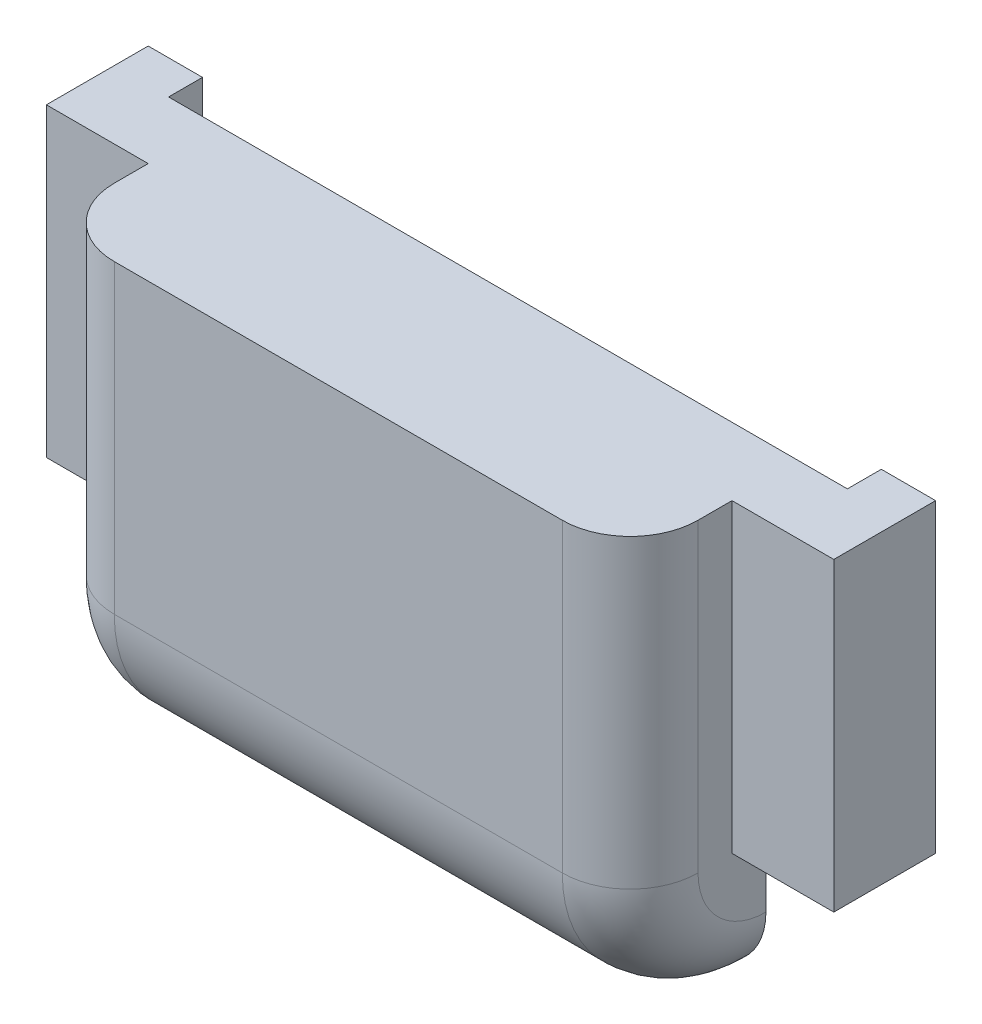
from build123d import *

# Parameters (mm, degrees)
SKETCH_1_W          = 8.6
SKETCH_1_H          = 6.5
EXTRUDE_1_DEPTH     = 3
FILLET_1_R          = 2
SKETCH_2_W          = 1.5
SKETCH_2_H          = 4.5
EXTRUDE_2_DEPTH     = 1.5
SKETCH_3_W          = 1.5
SKETCH_3_H          = 4.5
EXTRUDE_3_DEPTH     = 1.5
FILLET_2_R          = 1
FILLET_3_R          = 1
CUT_EXTRUDE_1_DEPTH = 1
SKETCH_5_W          = 10
SKETCH_5_H          = 4.5
CUT_EXTRUDE_2_DEPTH = 0.5


with BuildPart() as part:
    # 草图1 → 凸台-拉伸1 (new body)
    with BuildSketch(Plane.XY):
        Rectangle(SKETCH_1_W, SKETCH_1_H)
    extrude(amount=EXTRUDE_1_DEPTH)

    # 圆角1
    fillet_1_edges = [part.edges().sort_by_distance(p)[0] for p in [
        (0, -3.25, 3),
    ]]
    fillet(fillet_1_edges, radius=FILLET_1_R)

    # 草图2 → 凸台-拉伸2 (add)
    with BuildSketch(Plane(origin=(4.3, 0, 0), x_dir=(0, 0, -1), z_dir=(1, 0, 0))):
        with Locations((-0.75, 1)):
            Rectangle(SKETCH_2_W, SKETCH_2_H)
    extrude(amount=EXTRUDE_2_DEPTH)

    # 草图3 → 凸台-拉伸3 (add)
    with BuildSketch(Plane.ZY.offset(4.3)):
        with Locations((0.75, 1)):
            Rectangle(SKETCH_3_W, SKETCH_3_H)
    extrude(amount=EXTRUDE_3_DEPTH)

    # 圆角2
    fillet_2_edges = [part.edges().sort_by_distance(p)[0] for p in [
        (4.3, 1, 3),
        (4.3, -3.25, 0.5),
        (4.3, -2.664213562, 2.414213562),
    ]]
    fillet(fillet_2_edges, radius=FILLET_2_R)

    # 圆角3
    fillet_3_edges = [part.edges().sort_by_distance(p)[0] for p in [
        (-4.3, 1, 3),
        (-4.3, -3.25, 0.5),
        (-4.3, -2.664213562, 2.414213562),
    ]]
    fillet(fillet_3_edges, radius=FILLET_3_R)

    # 草图4 → 切除-拉伸1 (cut)
    with BuildSketch(Plane(origin=(0, 0, 0), x_dir=(-1, 0, 0), z_dir=(0, 0, -1))):
        with BuildLine():
            Line((-4.3, -1.25), (-4.3, -2.25))
            ThreePointArc((-4.3, -2.25), (-4.007106781, -2.957106781), (-3.3, -3.25))
            Line((-3.3, -3.25), (3.3, -3.25))
            ThreePointArc((3.3, -3.25), (4.007106781, -2.957106781), (4.3, -2.25))
            Line((4.3, -2.25), (4.3, -1.25))
            Line((4.3, -1.25), (-4.3, -1.25))
        make_face()
    extrude(amount=-CUT_EXTRUDE_1_DEPTH, mode=Mode.SUBTRACT)

    # 草图5 → 切除-拉伸2 (cut)
    with BuildSketch(Plane(origin=(0, 0, 0), x_dir=(-1, 0, 0), z_dir=(0, 0, -1))):
        with Locations((0, 1)):
            Rectangle(SKETCH_5_W, SKETCH_5_H)
    extrude(amount=-CUT_EXTRUDE_2_DEPTH, mode=Mode.SUBTRACT)


solid = part.part
